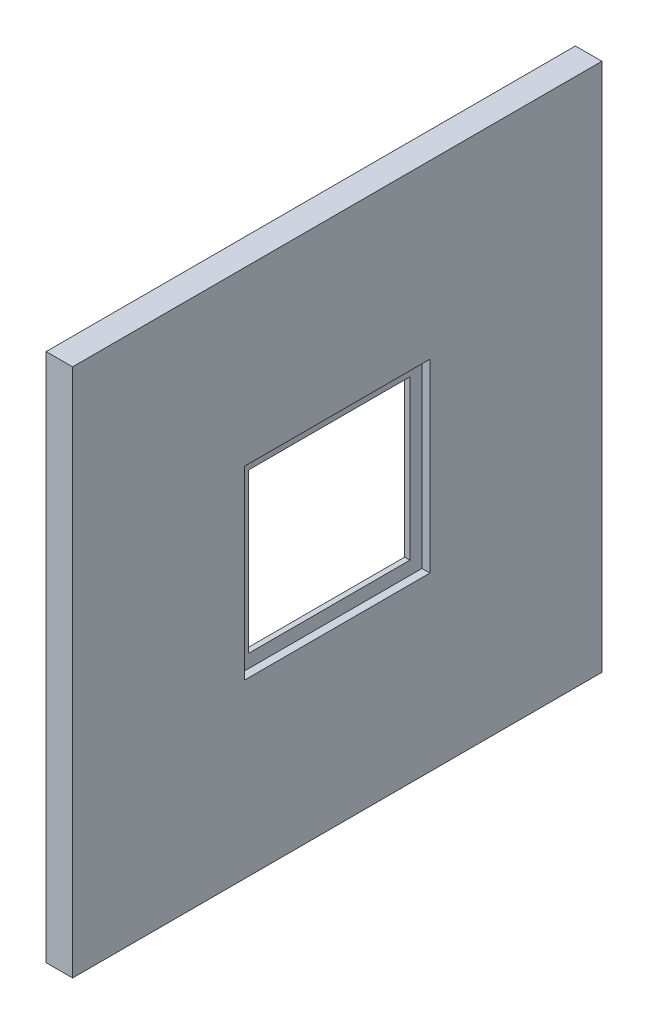
from build123d import *

# Parameters (mm, degrees)
SKETCH1_W           = 200
SKETCH1_H           = 200
BOSS_EXTRUDE1_DEPTH = 10
CUT_EXTRUDE1_DEPTH  = 5
SKETCH3_W           = 61.021512422
SKETCH3_H           = 60
CUT_EXTRUDE2_DEPTH  = 142.509716981
SKETCH4_W           = 70
SKETCH4_H           = 70
CUT_EXTRUDE3_DEPTH  = 3


with BuildPart() as part:
    # Sketch1 → Boss-Extrude1 (new body)
    with BuildSketch(Plane(origin=(0, 0, 0), x_dir=(0, 0, -1), z_dir=(1, 0, 0))):
        Rectangle(SKETCH1_W, SKETCH1_H)
    extrude(amount=BOSS_EXTRUDE1_DEPTH)

    # Sketch2 → Cut-Extrude1 (cut)
    with BuildSketch(Plane.ZY):
        Polygon((36.5, -36.5), (36.5, 36.5), (25.709845909, 36.5), (5.209845909, 45.5), (-5.209845909, 45.5), (-25.709845909, 36.5), (-36.5, 36.5), (-36.5, -36.5), align=None)
    extrude(amount=-CUT_EXTRUDE1_DEPTH, mode=Mode.SUBTRACT)

    # Sketch3 → Cut-Extrude2 (cut, through all)
    with BuildSketch(Plane.ZY.offset(-5)):
        Rectangle(SKETCH3_W, SKETCH3_H)
    extrude(amount=-CUT_EXTRUDE2_DEPTH, mode=Mode.SUBTRACT)

    # Sketch4 → Cut-Extrude3 (cut)
    with BuildSketch(Plane(origin=(10, 0, 0), x_dir=(0, 0, -1), z_dir=(1, 0, 0))):
        Rectangle(SKETCH4_W, SKETCH4_H)
    extrude(amount=-CUT_EXTRUDE3_DEPTH, mode=Mode.SUBTRACT)


solid = part.part
